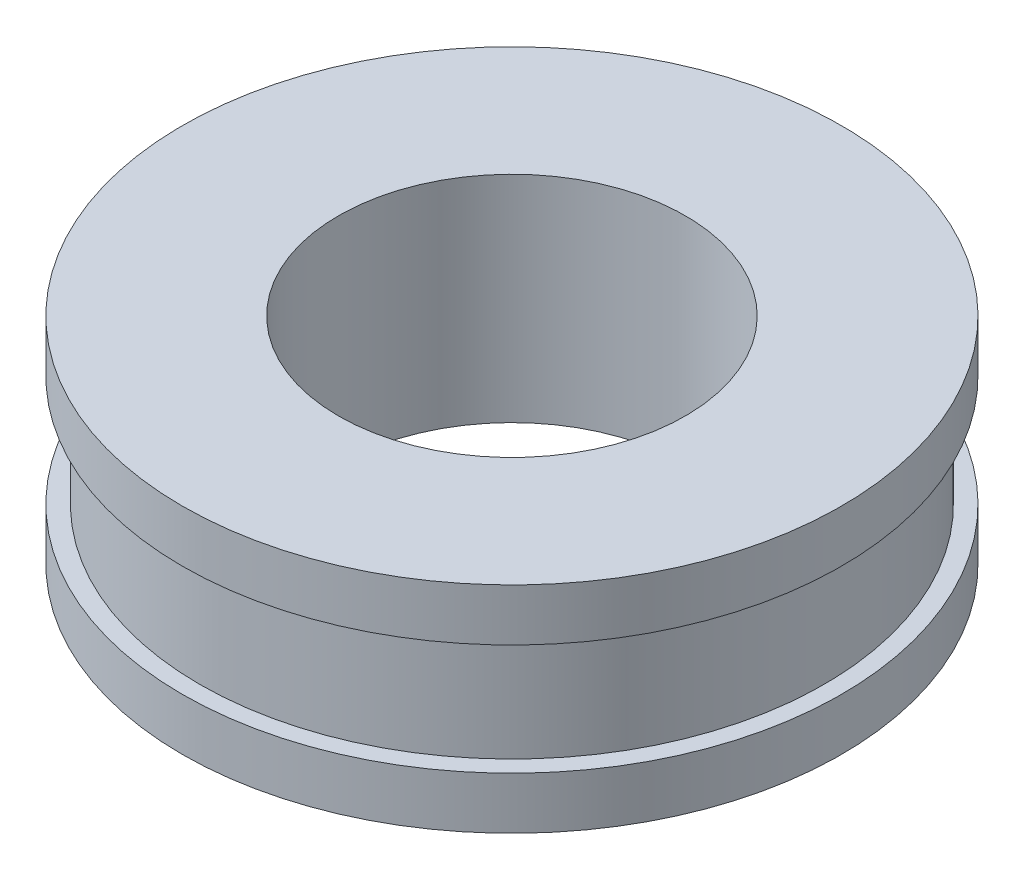
from build123d import *

# Parameters (mm, degrees)
SKETCH1_R           = 47.5
SKETCH1_R_2         = 25
BOSS_EXTRUDE1_DEPTH = 15.5
SKETCH3_R           = 47.5
SKETCH3_R_2         = 45
CUT_EXTRUDE1_DEPTH  = 8


with BuildPart() as part:
    # Sketch1 → Boss-Extrude1 (new, symmetric)
    with BuildSketch(Plane(origin=(0, 0, 0), x_dir=(1, 0, 0), z_dir=(0, 1, 0))):
        with Locations(Location((0, 0, 0), (0, 0, 270))):
            Circle(SKETCH1_R)
        with Locations(Location((0, 0, 0), (0, 0, 270))):
            Circle(SKETCH1_R_2, mode=Mode.SUBTRACT)
    extrude(amount=BOSS_EXTRUDE1_DEPTH, both=True)

    # Sketch3 → Cut-Extrude1 (cut, symmetric)
    with BuildSketch(Plane(origin=(0, 0, 0), x_dir=(1, 0, 0), z_dir=(0, 1, 0))):
        with Locations(Location((0, 0, 0), (0, 0, 270))):
            Circle(SKETCH3_R)
        with Locations(Location((0, 0, 0), (0, 0, 270))):
            Circle(SKETCH3_R_2, mode=Mode.SUBTRACT)
    extrude(amount=CUT_EXTRUDE1_DEPTH, both=True, mode=Mode.SUBTRACT)


solid = part.part
